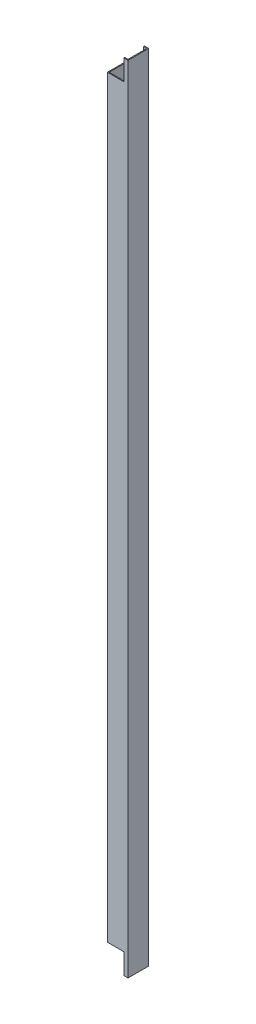
from build123d import *

# Parameters (mm, degrees)
SKETCH1_W           = 50
SKETCH1_H           = 50
SKETCH1_W_2         = 45.6
SKETCH1_H_2         = 45.6
BOSS_EXTRUDE1_DEPTH = 1923
SKETCH2_W           = 40
SKETCH2_H           = 50
CUT_EXTRUDE2_DEPTH  = 50


with BuildPart() as part:
    # Sketch1 → Boss-Extrude1 (new body)
    with BuildSketch(Plane(origin=(0, 0, 0), x_dir=(1, 0, 0), z_dir=(0, 1, 0))):
        with Locations((25, 25)):
            Rectangle(SKETCH1_W, SKETCH1_H)
        with Locations((25, 25)):
            Rectangle(SKETCH1_W_2, SKETCH1_H_2, mode=Mode.SUBTRACT)
    extrude(amount=BOSS_EXTRUDE1_DEPTH)

    # Sketch2 → Cut-Extrude2 (cut)
    with BuildSketch(Plane.XY):
        with Locations((20, 25)):
            Rectangle(SKETCH2_W, SKETCH2_H)
        with Locations((20, 1898)):
            Rectangle(SKETCH2_W, SKETCH2_H)
    extrude(amount=-CUT_EXTRUDE2_DEPTH, mode=Mode.SUBTRACT)


solid = part.part
